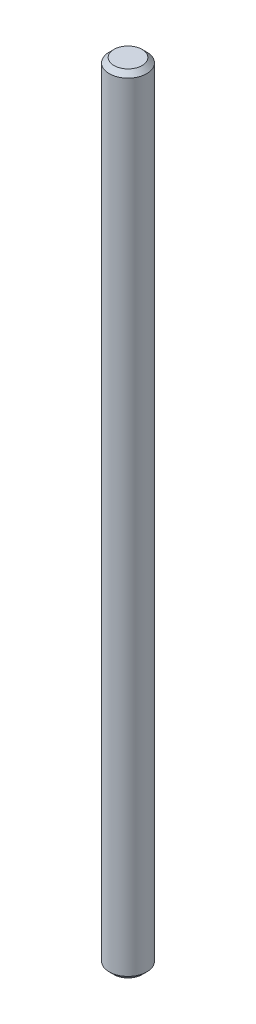
from build123d import *

# Parameters (mm, degrees)
SKETCH1_R           = 2
BOSS_EXTRUDE1_DEPTH = 42
CHAMFER1_SIZE       = 0.5


with BuildPart() as part:
    # Sketch1 → Boss-Extrude1 (new, symmetric)
    with BuildSketch(Plane(origin=(0, 0, 0), x_dir=(1, 0, 0), z_dir=(0, 1, 0))):
        with Locations(Location((0, 0, 0), (0, 0, 90))):
            Circle(SKETCH1_R)
    extrude(amount=BOSS_EXTRUDE1_DEPTH, both=True)

    # Chamfer1
    chamfer1_edges = [part.edges().sort_by_distance(p)[0] for p in [
        (0, -42, 2),
        (0, 42, 2),
    ]]
    chamfer(chamfer1_edges, length=CHAMFER1_SIZE)


solid = part.part
